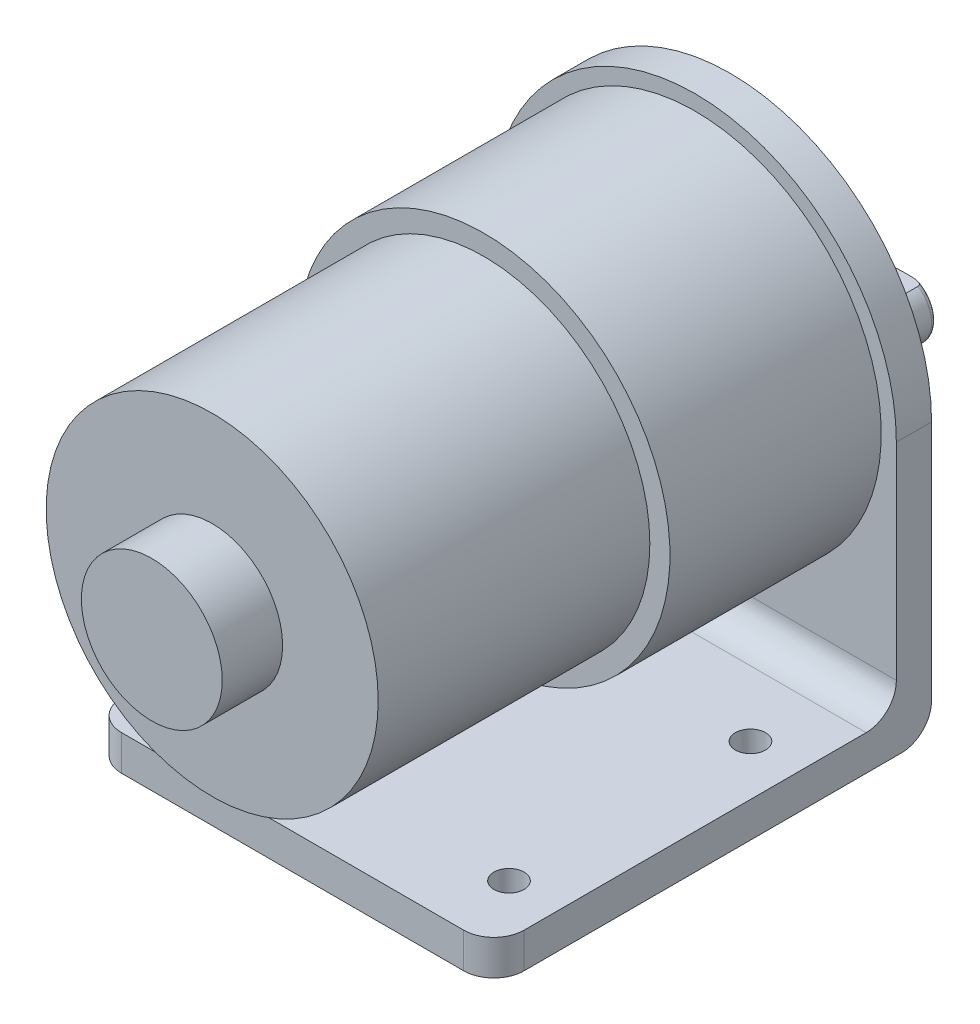
from build123d import *

# Parameters (mm, degrees)
SKETCH1_R           = 18.5
BOSS_EXTRUDE1_DEPTH = 21
SKETCH2_R           = 16.5
BOSS_EXTRUDE2_DEPTH = 27
SKETCH3_R           = 7
BOSS_EXTRUDE3_DEPTH = 6
BOSS_EXTRUDE4_DEPTH = 3.5
SKETCH5_W           = 40
SKETCH5_H           = 3.5
BOSS_EXTRUDE5_DEPTH = 40
FILLET1_R           = 3
SKETCH6_R           = 6
BOSS_EXTRUDE6_DEPTH = 6
SKETCH7_R           = 3
BOSS_EXTRUDE7_DEPTH = 15
FILLET2_R           = 0.5
CUT_EXTRUDE1_START  = -12
CUT_EXTRUDE1_DEPTH  = 12
CUT_EXTRUDE2_REACH  = 76.33
SKETCH9_R           = 1.5


with BuildPart() as part:
    # Sketch1 → Boss-Extrude1 (new body)
    with BuildSketch(Plane.XY):
        with Locations(Location((0, 0, 0), (0, 0, 180))):
            Circle(SKETCH1_R)
    extrude(amount=BOSS_EXTRUDE1_DEPTH)

    # Sketch2 → Boss-Extrude2 (add)
    with BuildSketch(Plane.XY.offset(21)):
        Circle(SKETCH2_R)
    extrude(amount=BOSS_EXTRUDE2_DEPTH)

    # Sketch3 → Boss-Extrude3 (add)
    with BuildSketch(Plane.XY.offset(48)):
        Circle(SKETCH3_R)
    extrude(amount=BOSS_EXTRUDE3_DEPTH)

    # Sketch4 → Boss-Extrude4 (add)
    with BuildSketch(Plane(origin=(0, 0, 0), x_dir=(-1, 0, 0), z_dir=(0, 0, -1))):
        with BuildLine():
            Line((-20, 0), (-20, -27))
            Line((-20, -27), (20, -27))
            Line((20, -27), (20, 0))
            ThreePointArc((20, 0), (0, 20), (-20, 0))
        make_face()
        with BuildLine():
            Line((6.5, 5), (6.5, -8.5))
            ThreePointArc((6.5, -8.5), (0, -15), (-6.5, -8.5))
            Line((-6.5, -8.5), (-6.5, 5))
            ThreePointArc((-6.5, 5), (0, 11.5), (6.5, 5))
        make_face(mode=Mode.SUBTRACT)
    extrude(amount=BOSS_EXTRUDE4_DEPTH)

    # Sketch5 → Boss-Extrude5 (add)
    with BuildSketch(Plane.XY):
        with Locations((0, -25.25)):
            Rectangle(SKETCH5_W, SKETCH5_H)
    extrude(amount=BOSS_EXTRUDE5_DEPTH)

    # Fillet1
    fillet1_edges = [part.edges().sort_by_distance(p)[0] for p in [
        (0, -27, -3.5),
        (0, -23.5, 0),
        (20, -25.25, 40),
        (-20, -25.25, 40),
    ]]
    fillet(fillet1_edges, radius=FILLET1_R)

    # Sketch6 → Boss-Extrude6 (add)
    with BuildSketch(Plane(origin=(0, 0, 0), x_dir=(-1, 0, 0), z_dir=(0, 0, -1))):
        with Locations(Location((0, -8.5, 0), (0, 0, 180))):
            Circle(SKETCH6_R)
    extrude(amount=BOSS_EXTRUDE6_DEPTH)

    # Sketch7 → Boss-Extrude7 (add)
    with BuildSketch(Plane(origin=(0, 0, -6), x_dir=(-1, 0, 0), z_dir=(0, 0, -1))):
        with Locations((0, -8.5)):
            Circle(SKETCH7_R)
    extrude(amount=BOSS_EXTRUDE7_DEPTH)

    # Fillet2
    fillet2_edges = [part.edges().sort_by_distance(p)[0] for p in [
        (3, -8.5, -21),
    ]]
    fillet(fillet2_edges, radius=FILLET2_R)

    # Sketch8 → Cut-Extrude1 (cut)
    with BuildSketch(Plane(origin=(0, 0, -21), x_dir=(-1, 0, 0), z_dir=(0, 0, -1)).offset(CUT_EXTRUDE1_START)):
        with BuildLine():
            Line((-1.658312395, -6), (1.658312395, -6))
            ThreePointArc((1.658312395, -6), (0, -5.5), (-1.658312395, -6))
        make_face()
    extrude(amount=CUT_EXTRUDE1_DEPTH, mode=Mode.SUBTRACT)

    # Sketch9 → Cut-Extrude2 (cut, up to next)
    with BuildSketch(Plane.XZ.offset(27), mode=Mode.PRIVATE) as cut_extrude2_sk1:
        with Locations(Location((15, 33.5, 0), (0, 0, 270))):
            Circle(SKETCH9_R)
    cut_extrude2_tool1 = extrude(cut_extrude2_sk1.sketch, amount=-CUT_EXTRUDE2_REACH, mode=Mode.PRIVATE) & part.part
    # Sketch9 → Cut-Extrude2 (cut, up to next)
    with BuildSketch(Plane.XZ.offset(27), mode=Mode.PRIVATE) as cut_extrude2_sk2:
        with Locations(Location((15, 9.5, 0), (0, 0, 270))):
            Circle(SKETCH9_R)
    cut_extrude2_tool2 = extrude(cut_extrude2_sk2.sketch, amount=-CUT_EXTRUDE2_REACH, mode=Mode.PRIVATE) & part.part
    # Sketch9 → Cut-Extrude2 (cut, up to next)
    with BuildSketch(Plane.XZ.offset(27), mode=Mode.PRIVATE) as cut_extrude2_sk3:
        with Locations(Location((-15, 33.5, 0), (0, 0, 270))):
            Circle(SKETCH9_R)
    cut_extrude2_tool3 = extrude(cut_extrude2_sk3.sketch, amount=-CUT_EXTRUDE2_REACH, mode=Mode.PRIVATE) & part.part
    # Sketch9 → Cut-Extrude2 (cut, up to next)
    with BuildSketch(Plane.XZ.offset(27), mode=Mode.PRIVATE) as cut_extrude2_sk4:
        with Locations(Location((-15, 9.5, 0), (0, 0, 270))):
            Circle(SKETCH9_R)
    cut_extrude2_tool4 = extrude(cut_extrude2_sk4.sketch, amount=-CUT_EXTRUDE2_REACH, mode=Mode.PRIVATE) & part.part
    add(cut_extrude2_tool1.solids().sort_by_distance((15, -27, 33.5))[0], mode=Mode.SUBTRACT)
    add(cut_extrude2_tool2.solids().sort_by_distance((15, -27, 9.5))[0], mode=Mode.SUBTRACT)
    add(cut_extrude2_tool3.solids().sort_by_distance((-15, -27, 33.5))[0], mode=Mode.SUBTRACT)
    add(cut_extrude2_tool4.solids().sort_by_distance((-15, -27, 9.5))[0], mode=Mode.SUBTRACT)


solid = part.part
